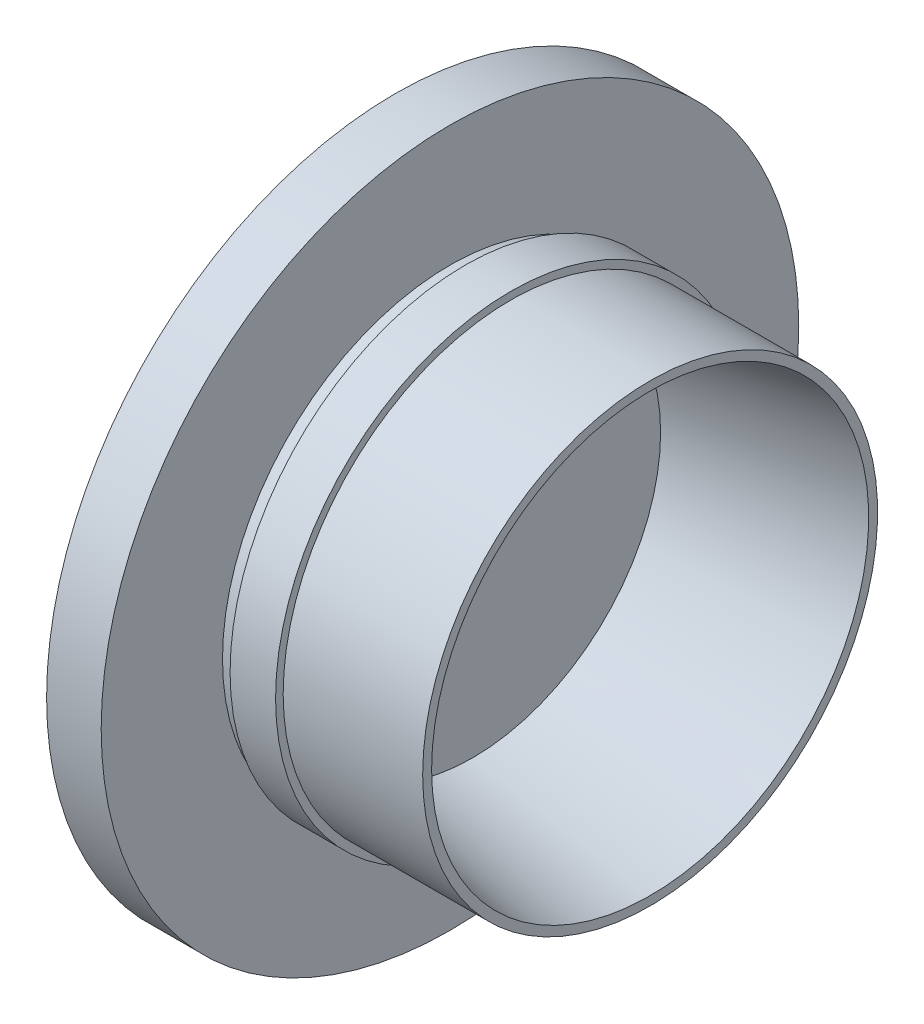
from build123d import *


with BuildPart() as part:
    # 草图1 → 旋转1 (revolve)
    with BuildSketch(Plane.XY, mode=Mode.PRIVATE) as revolve_1_sk:
        Polygon((0, 30), (1, 30), (1, 17), (1, 0), (10.2, 0), (10.2, 17), (10.2, 24.78), (33.6, 28.8226), (33.6, 30), (15.2, 30), (15.2, 31), (9.2, 31), (9.2, 30), (7.2, 30), (7.2, 46), (0, 46), align=None)
    revolve(revolve_1_sk.sketch.rotate(Axis((0, 0, 0), (1, 0, 0)), 90), axis=Axis((0, 0, 0), (1, 0, 0)))


solid = part.part
